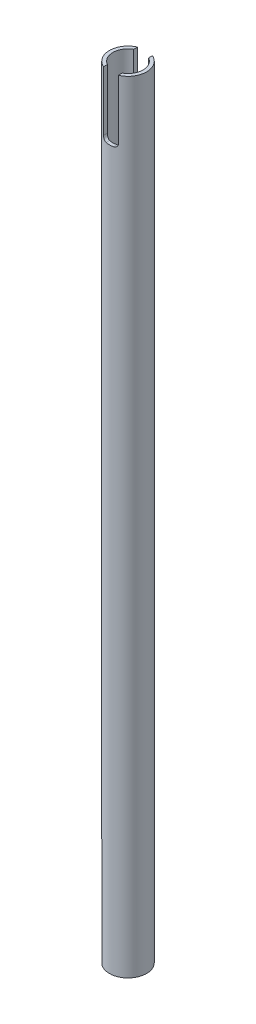
from build123d import *

# Parameters (mm, degrees)
BOSS_EXTRUDE1_START     = -163.416678
SKETCH1_R               = 7.9375
SKETCH1_R_2             = 6.4643
BOSS_EXTRUDE1_DEPTH     = 333.562160318
CUT_EXTRUDE1_DEPTH      = 171.515374573
CUT_EXTRUDE1_DEPTH_BACK = 171.515374573


with BuildPart() as part:
    # Sketch1 → Boss-Extrude1 (new body)
    with BuildSketch(Plane(origin=(0, 0, 0), x_dir=(1, 0, 0), z_dir=(0, 1, 0)).offset(BOSS_EXTRUDE1_START)):
        with Locations(Location((0, 0, 0), (0, 0, 270))):
            Circle(SKETCH1_R)
        with Locations(Location((0, 0, 0), (0, 0, 270))):
            Circle(SKETCH1_R_2, mode=Mode.SUBTRACT)
    extrude(amount=BOSS_EXTRUDE1_DEPTH)

    # Sketch2 → Cut-Extrude1 (cut, two sides: drawn at the far end of the back side and taken through both)
    with BuildSketch(Plane.XY.offset(-CUT_EXTRUDE1_DEPTH_BACK)):
        with BuildLine():
            Line((-3.175, 170.145482762), (3.175, 170.145482762))
            Line((3.175, 170.145482762), (3.175, 144.745482762))
            ThreePointArc((3.175, 144.745482762), (2.710032015, 143.622950747), (1.5875, 143.157982762))
            Line((1.5875, 143.157982762), (-1.5875, 143.157982762))
            ThreePointArc((-1.5875, 143.157982762), (-2.710032015, 143.622950747), (-3.175, 144.745482762))
            Line((-3.175, 144.745482762), (-3.175, 170.145482762))
        make_face()
    extrude(amount=CUT_EXTRUDE1_DEPTH + CUT_EXTRUDE1_DEPTH_BACK, mode=Mode.SUBTRACT)


solid = part.part
